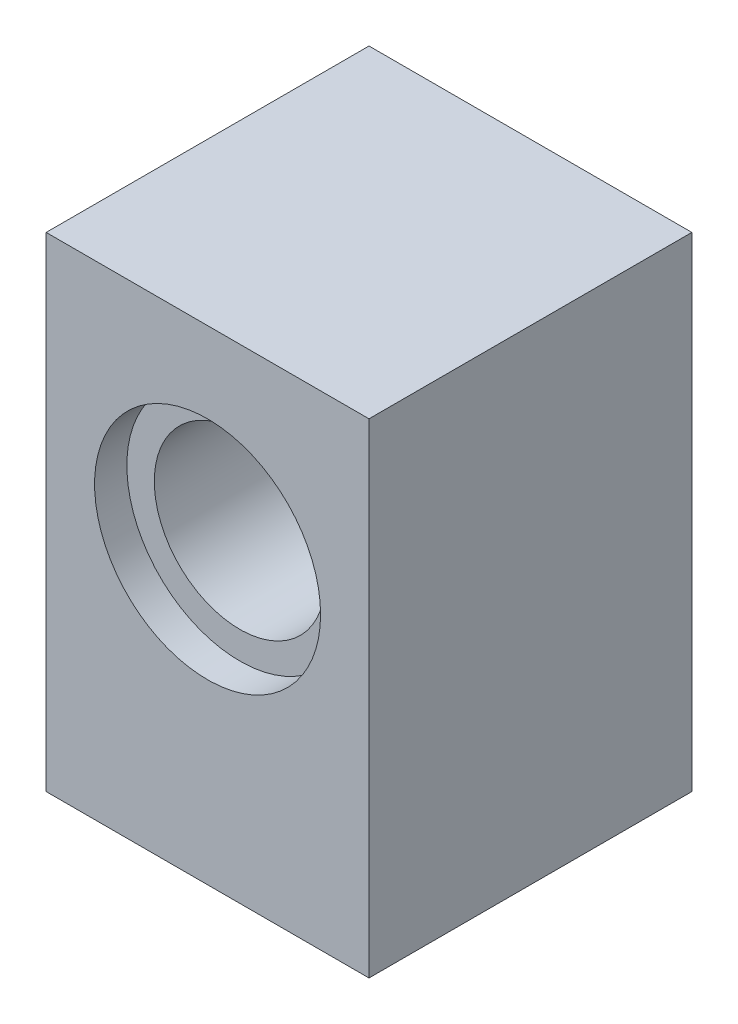
from build123d import *

# Parameters (mm, degrees)
SKETCH1_W           = 10
SKETCH1_H           = 10
BOSS_EXTRUDE1_DEPTH = 15
SKETCH2_R           = 3.5
CUT_EXTRUDE1_DEPTH  = 1
SKETCH3_R           = 2.65
CUT_EXTRUDE2_DEPTH  = 7.9
SKETCH4_R           = 0.75
CUT_EXTRUDE3_DEPTH  = 21.104974509


with BuildPart() as part:
    # Sketch1 → Boss-Extrude1 (new body)
    with BuildSketch(Plane(origin=(0, 0, 0), x_dir=(1, 0, 0), z_dir=(0, 1, 0))):
        with Locations((5, 5)):
            Rectangle(SKETCH1_W, SKETCH1_H)
    extrude(amount=BOSS_EXTRUDE1_DEPTH)

    # Sketch2 → Cut-Extrude1 (cut)
    with BuildSketch(Plane.XY):
        with Locations((5, 9)):
            Circle(SKETCH2_R)
    extrude(amount=-CUT_EXTRUDE1_DEPTH, mode=Mode.SUBTRACT)

    # Sketch3 → Cut-Extrude2 (cut)
    with BuildSketch(Plane.XY.offset(-1)):
        with Locations((5, 9)):
            Circle(SKETCH3_R)
    extrude(amount=-CUT_EXTRUDE2_DEPTH, mode=Mode.SUBTRACT)

    # Sketch4 → Cut-Extrude3 (cut, through all)
    with BuildSketch(Plane.XY.offset(-8.9)):
        with Locations((5, 9)):
            Circle(SKETCH4_R)
    extrude(amount=-CUT_EXTRUDE3_DEPTH, mode=Mode.SUBTRACT)


solid = part.part
